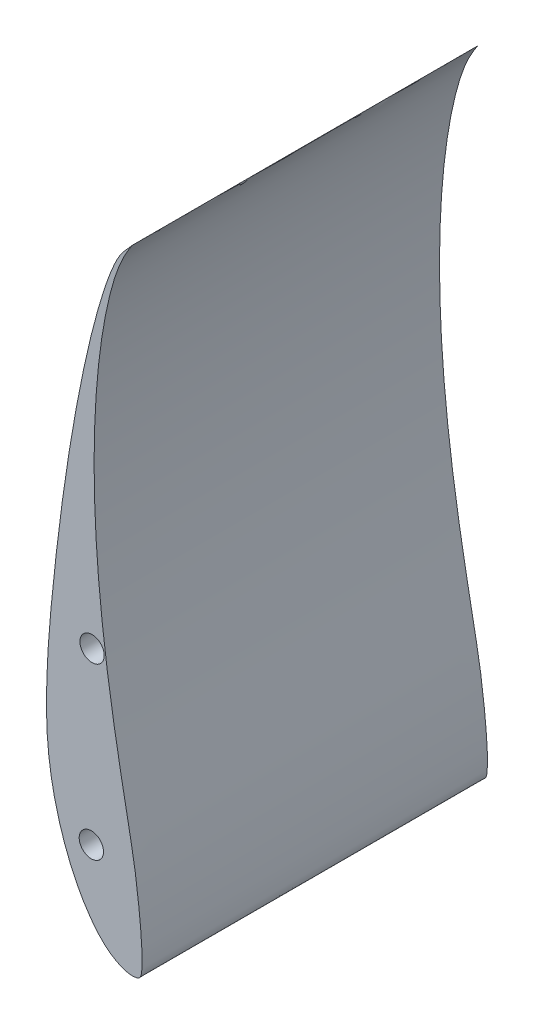
from build123d import *

# Parameters (mm, degrees)
SKETCH1_R           = 5
BOSS_EXTRUDE1_DEPTH = 142


with BuildPart() as part:
    # Sketch1 → Boss-Extrude1 (new body)
    with BuildSketch(Plane.XY):
        with BuildLine():
            add(Edge.make_bspline(
                [(0.819865797, 114.813652867), (0.813246926, 114.815209386), (0.176425634, 113.960493852), (-0.532817508, 113.237641744), (-2.014211483, 111.63261807), (-3.590131405, 109.739065396), (-5.178834029, 107.148847981), (-6.718466474, 103.927892939), (-8.325259418, 100.039442167), (-9.976839755, 95.489422808), (-11.661540296, 90.299062059), (-13.364733827, 84.495304894), (-15.078426374, 78.110650736), (-16.786882966, 71.180352885), (-18.477736169, 63.744144549), (-20.140424924, 55.846347362), (-21.766401741, 47.535188936), (-23.335658015, 38.859244262), (-24.845951729, 29.873147393), (-26.277834946, 20.628685923), (-27.6341037, 11.185644022), (-28.904010238, 1.604540318), (-30.083490926, -8.045229211), (-31.18089713, -17.686521976), (-32.168538455, -27.239522435), (-33.027930071, -36.626403754), (-33.710700725, -45.781146282), (-34.180359304, -54.651454769), (-34.383179762, -63.187980789), (-34.361590849, -71.346992933), (-33.962101759, -79.113271486), (-33.152555114, -86.489824894), (-32.007844153, -93.506681455), (-30.524881209, -100.165534692), (-28.785900294, -106.459543607), (-26.821701423, -112.362077468), (-24.678217457, -117.848033345), (-22.366932397, -122.883320864), (-19.934771977, -127.451792098), (-17.40939456, -131.528593063), (-14.825021201, -135.088157718), (-12.23643082, -138.129017389), (-9.615367008, -140.60707427), (-6.984528233, -142.510538036), (-4.425072469, -143.916578779), (-1.994990485, -144.817702096), (0.247974452, -145.2470874), (2.144991147, -145.164204416), (3.884861133, -144.675810072), (4.74854534, -142.860370088), (4.869717514, -140.419487193), (4.987158062, -137.080368493), (4.806080714, -132.881191066), (4.473315731, -127.869413914), (3.940298387, -122.100812885), (3.219103002, -115.634416752), (2.294254026, -108.501757362), (1.001639969, -100.706320341), (-0.619277106, -92.210150375), (-2.383352133, -82.970772333), (-4.245962451, -73.033347541), (-6.129797053, -62.460293478), (-7.964157835, -51.329259031), (-9.68779069, -39.72659954), (-11.237466566, -27.752306188), (-12.56806264, -15.514060444), (-13.619844048, -3.127468395), (-14.365427377, 9.283167452), (-14.775315831, 21.588187813), (-14.827087679, 33.654104808), (-14.517225267, 45.346304236), (-13.852982534, 56.530903488), (-12.84293, 67.073409341), (-11.525838418, 76.84830695), (-9.939924821, 85.728330279), (-8.138303421, 93.609364987), (-6.210488261, 100.346167223), (-4.152957493, 105.859545091), (-2.270053424, 109.793198278), (-0.529057077, 112.693375761), (0.14467979, 113.807499238), (0.826619229, 114.812064704), (0.819865797, 114.813652867)],
                knots=[0, 0, 0, 0, 0.000979678, 0.003648862, 0.007483499, 0.012095277, 0.017525591, 0.02405178, 0.031783051, 0.040677828, 0.050710301, 0.061833229, 0.07398925, 0.087118173, 0.101145049, 0.115990637, 0.131570422, 0.147788379, 0.164550917, 0.181757895, 0.199311955, 0.217095072, 0.234990228, 0.252856883, 0.270540594, 0.287886779, 0.304773438, 0.321101419, 0.336806063, 0.351800033, 0.366031063, 0.379615675, 0.392652963, 0.405170359, 0.417171919, 0.428603517, 0.439418959, 0.449596586, 0.459102079, 0.467907878, 0.475988301, 0.483308969, 0.489874508, 0.49580325, 0.501149412, 0.505903073, 0.510046769, 0.513579311, 0.516446927, 0.519350053, 0.523823355, 0.529973794, 0.537715654, 0.546967844, 0.557637367, 0.569620481, 0.582804124, 0.597246961, 0.613135037, 0.6304436, 0.649056124, 0.668822257, 0.689594964, 0.711189651, 0.733426689, 0.756094118, 0.778988554, 0.801889683, 0.824566598, 0.846792285, 0.868338291, 0.888978163, 0.908492011, 0.926658768, 0.943286193, 0.95816921, 0.971135822, 0.981955623, 0.990251791, 0.995852565, 0.999000406, 1, 1, 1, 1], degree=3))
        make_face()
        with Locations((-15.92100048, -106.954454188)):
            Circle(SKETCH1_R, mode=Mode.SUBTRACT)
        with Locations((-15.629141039, -36.954454188)):
            Circle(SKETCH1_R, mode=Mode.SUBTRACT)
    extrude(amount=BOSS_EXTRUDE1_DEPTH)


solid = part.part
